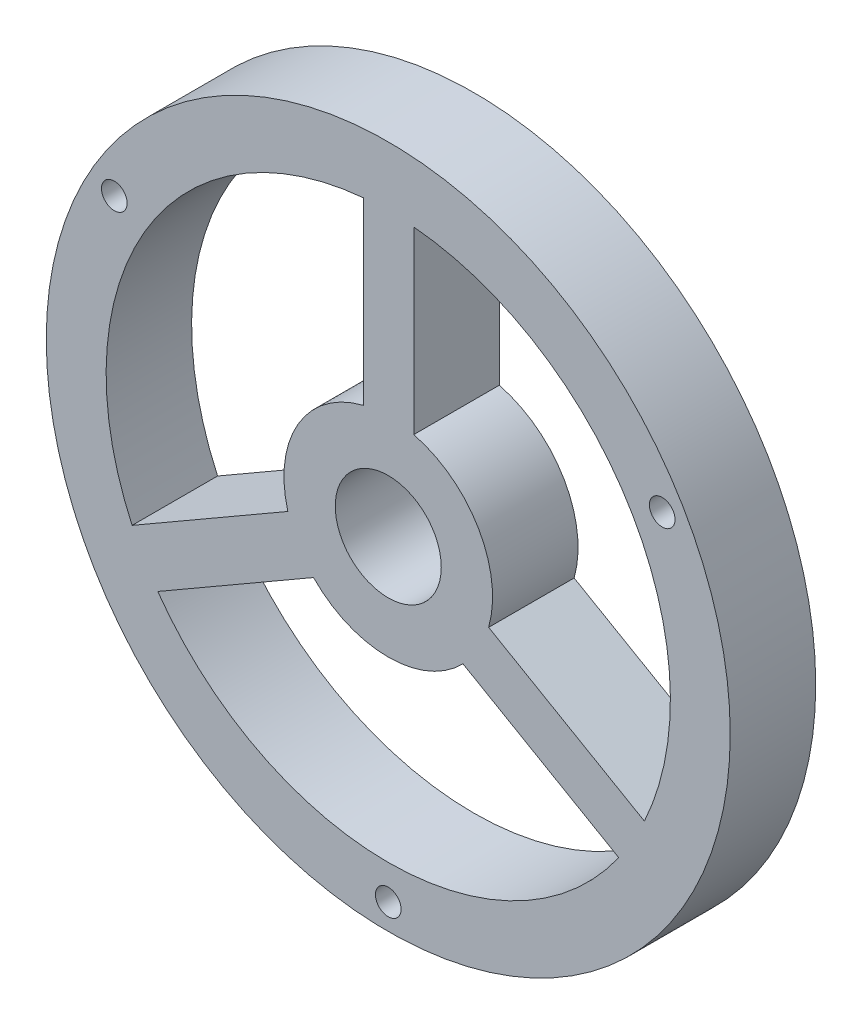
from build123d import *

# Parameters (mm, degrees)
SKETCH_1_R          = 3.1
EXTRUDE_2_DEPTH     = 5
SKETCH_2_R          = 0.75
CUT_EXTRUDE_1_DEPTH = 5


with BuildPart() as part:
    # 草图1 → 凸台-拉伸2 (new body)
    # profile 1 of 13: a face of its own
    with BuildSketch(Plane.XY):
        with BuildLine():
            ThreePointArc((46.84834221, 47.872411392), (30.988983248, 37.947419694), (30.274748906, 19.252110223))
            Line((30.274748906, 19.252110223), (33.316224884, 21.008107198))
            ThreePointArc((33.316224884, 21.008107198), (34.020092006, 36.197446789), (46.84834221, 44.361236525))
            Line((46.84834221, 44.361236525), (46.84834221, 47.872411392))
        make_face()
    # profile 2 of 13: a face of its own
    with BuildSketch(Plane.XY):
        with BuildLine():
            Line((63.276723826, 21.008107198), (66.318199804, 19.252110223))
            ThreePointArc((66.318199804, 19.252110223), (67.795634709, 23.477127615), (68.296474355, 27.924907455))
            ThreePointArc((68.296474355, 27.924907455), (62.956439097, 41.529518209), (49.787930978, 47.869218853))
            Line((49.787930978, 47.869218853), (49.787930978, 44.357361841))
            ThreePointArc((49.787930978, 44.357361841), (60.479639672, 39.052372704), (64.796474355, 27.924907455))
            ThreePointArc((64.796474355, 27.924907455), (64.41205868, 24.384011825), (63.276723826, 21.008107198))
        make_face()
    # profile 3 of 13: a face of its own
    with BuildSketch(Plane.XY):
        with BuildLine():
            ThreePointArc((31.774748906, 16.654034012), (48.296474355, 7.924907455), (64.818199804, 16.654034012))
            Line((64.818199804, 16.654034012), (61.776723826, 18.410030987))
            ThreePointArc((61.776723826, 18.410030987), (48.296474355, 11.424907455), (34.816224884, 18.410030987))
            Line((34.816224884, 18.410030987), (31.774748906, 16.654034012))
        make_face()
    # profile 4 of 13: a face of its own
    with BuildSketch(Plane.XY):
        with BuildLine():
            ThreePointArc((30.274748906, 19.252110223), (30.975966279, 17.924907455), (31.774748906, 16.654034012))
            Line((31.774748906, 16.654034012), (34.816224884, 18.410030987))
            ThreePointArc((34.816224884, 18.410030987), (34.007055193, 19.674907455), (33.316224884, 21.008107198))
            Line((33.316224884, 21.008107198), (30.274748906, 19.252110223))
        make_face()
    # profile 5 of 13: a face of its own
    with BuildSketch(Plane.XY):
        with BuildLine():
            ThreePointArc((33.316224884, 21.008107198), (34.007055193, 19.674907455), (34.816224884, 18.410030987))
            Line((34.816224884, 18.410030987), (43.925927509, 23.66952025))
            ThreePointArc((43.925927509, 23.66952025), (43.013719392, 24.874907455), (42.425927509, 26.267596461))
            Line((42.425927509, 26.267596461), (33.316224884, 21.008107198))
        make_face()
    # profile 6 of 13: a face of its own
    with BuildSketch(Plane.XY):
        with BuildLine():
            Line((52.565394479, 27.19229608), (54.167021201, 26.267596461))
            ThreePointArc((54.167021201, 26.267596461), (54.338838783, 27.088347762), (54.396474355, 27.924907455))
            ThreePointArc((54.396474355, 27.924907455), (53.108328748, 31.67404833), (49.787930978, 33.839766468))
            Line((49.787930978, 33.839766468), (49.787930978, 32.638782116))
            Line((49.787930978, 32.638782116), (46.84834221, 32.638782116))
            Line((46.84834221, 32.638782116), (46.84834221, 33.850522469))
            ThreePointArc((46.84834221, 33.850522469), (43.027133101, 30.998023585), (42.425927509, 26.267596461))
            Line((42.425927509, 26.267596461), (43.927397053, 27.134470306))
            Line((43.927397053, 27.134470306), (45.427397053, 24.536394095))
            Line((45.427397053, 24.536394095), (43.925927509, 23.66952025))
            ThreePointArc((43.925927509, 23.66952025), (48.296474355, 21.824907455), (52.667021201, 23.66952025))
            Line((52.667021201, 23.66952025), (51.065394479, 24.594219869))
            Line((51.065394479, 24.594219869), (52.565394479, 27.19229608))
        make_face()
        with Locations((48.296474355, 27.924907455)):
            Circle(SKETCH_1_R, mode=Mode.SUBTRACT)
    # profile 7 of 13: a face of its own
    with BuildSketch(Plane.XY):
        with BuildLine():
            ThreePointArc((42.425927509, 26.267596461), (43.013719392, 24.874907455), (43.925927509, 23.66952025))
            Line((43.925927509, 23.66952025), (45.427397053, 24.536394095))
            Line((45.427397053, 24.536394095), (43.927397053, 27.134470306))
            Line((43.927397053, 27.134470306), (42.425927509, 26.267596461))
        make_face()
    # profile 8 of 13: a face of its own
    with BuildSketch(Plane.XY):
        with BuildLine():
            ThreePointArc((52.667021201, 23.66952025), (53.579229318, 24.874907455), (54.167021201, 26.267596461))
            Line((54.167021201, 26.267596461), (52.565394479, 27.19229608))
            Line((52.565394479, 27.19229608), (51.065394479, 24.594219869))
            Line((51.065394479, 24.594219869), (52.667021201, 23.66952025))
        make_face()
    # profile 9 of 13: a face of its own
    with BuildSketch(Plane.XY):
        with BuildLine():
            Line((49.787930978, 32.638782116), (49.787930978, 33.839766468))
            ThreePointArc((49.787930978, 33.839766468), (48.3187942, 34.024866621), (46.84834221, 33.850522469))
            Line((46.84834221, 33.850522469), (46.84834221, 32.638782116))
            Line((46.84834221, 32.638782116), (49.787930978, 32.638782116))
        make_face()
    # profile 10 of 13: a face of its own
    with BuildSketch(Plane.XY):
        with BuildLine():
            Line((49.787930978, 33.839766468), (49.787930978, 44.357361841))
            ThreePointArc((49.787930978, 44.357361841), (48.318223053, 44.424893122), (46.84834221, 44.361236525))
            Line((46.84834221, 44.361236525), (46.84834221, 33.850522469))
            ThreePointArc((46.84834221, 33.850522469), (48.3187942, 34.024866621), (49.787930978, 33.839766468))
        make_face()
    # profile 11 of 13: a face of its own
    with BuildSketch(Plane.XY):
        with BuildLine():
            ThreePointArc((61.776723826, 18.410030987), (62.585893517, 19.674907455), (63.276723826, 21.008107198))
            Line((63.276723826, 21.008107198), (54.167021201, 26.267596461))
            ThreePointArc((54.167021201, 26.267596461), (53.579229318, 24.874907455), (52.667021201, 23.66952025))
            Line((52.667021201, 23.66952025), (61.776723826, 18.410030987))
        make_face()
    # profile 12 of 13: a face of its own
    with BuildSketch(Plane.XY):
        with BuildLine():
            ThreePointArc((64.818199804, 16.654034012), (65.616982431, 17.924907455), (66.318199804, 19.252110223))
            Line((66.318199804, 19.252110223), (63.276723826, 21.008107198))
            ThreePointArc((63.276723826, 21.008107198), (62.585893517, 19.674907455), (61.776723826, 18.410030987))
            Line((61.776723826, 18.410030987), (64.818199804, 16.654034012))
        make_face()
    # profile 13 of 13: a face of its own
    with BuildSketch(Plane.XY):
        with BuildLine():
            Line((49.787930978, 44.357361841), (49.787930978, 47.869218853))
            ThreePointArc((49.787930978, 47.869218853), (48.318195328, 47.92489566), (46.84834221, 47.872411392))
            Line((46.84834221, 47.872411392), (46.84834221, 44.361236525))
            ThreePointArc((46.84834221, 44.361236525), (48.318223053, 44.424893122), (49.787930978, 44.357361841))
        make_face()
    extrude(amount=EXTRUDE_2_DEPTH)

    # 草图2 → 切除-拉伸1 (cut)
    with BuildSketch(Plane.XY.offset(5)):
        with Locations((32.275004385, 37.174907455)):
            Circle(SKETCH_2_R)
        with Locations((64.317944325, 37.174907455)):
            Circle(SKETCH_2_R)
        with Locations((48.296474355, 9.424907455)):
            Circle(SKETCH_2_R)
    extrude(amount=-CUT_EXTRUDE_1_DEPTH, mode=Mode.SUBTRACT)


solid = part.part
